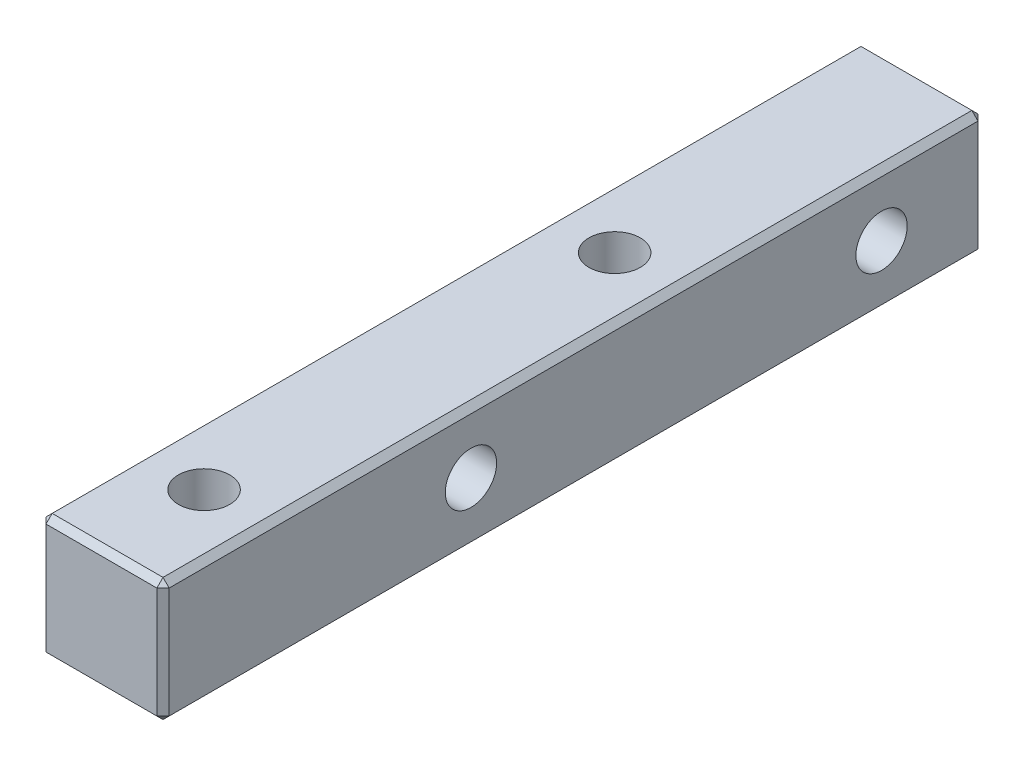
from build123d import *

# Parameters (mm, degrees)
SKETCH_1_W      = 6
SKETCH_1_H      = 6
EXTRUDE_1_DEPTH = 20
HOLE_WIZARD_1_D = 2.5
HOLE_WIZARD_2_D = 2.5
CHAMFER_1_SIZE  = 0.3


with BuildPart() as part:
    # 草图1 → 凸台-拉伸1 (new, symmetric)
    with BuildSketch(Plane.XY):
        Rectangle(SKETCH_1_W, SKETCH_1_H)
    extrude(amount=EXTRUDE_1_DEPTH, both=True)

    # Hole Wizard 1 (through all)
    with Locations(Plane.ZY.offset(3)):
        with Locations((-15, 0), (5, 0)):
            Hole(HOLE_WIZARD_1_D / 2)

    # Hole Wizard 2 (through all)
    with Locations(Plane(origin=(0, 3, 0), x_dir=(1, 0, 0), z_dir=(0, 1, 0))):
        with Locations((0, 5), (0, -15)):
            Hole(HOLE_WIZARD_2_D / 2)

    # 倒角1
    chamfer_1_edges = [part.edges().sort_by_distance(p)[0] for p in [
        (-3, 0, 20),
        (0, -3, 20),
        (3, 0, 20),
        (0, -3, -20),
        (-3, 0, -20),
        (0, 3, -20),
        (3, 0, -20),
        (3, -3, 0),
        (-3, -3, 0),
        (-3, 3, 0),
        (3, 3, 0),
        (0, 3, 20),
    ]]
    chamfer(chamfer_1_edges, length=CHAMFER_1_SIZE)


solid = part.part
